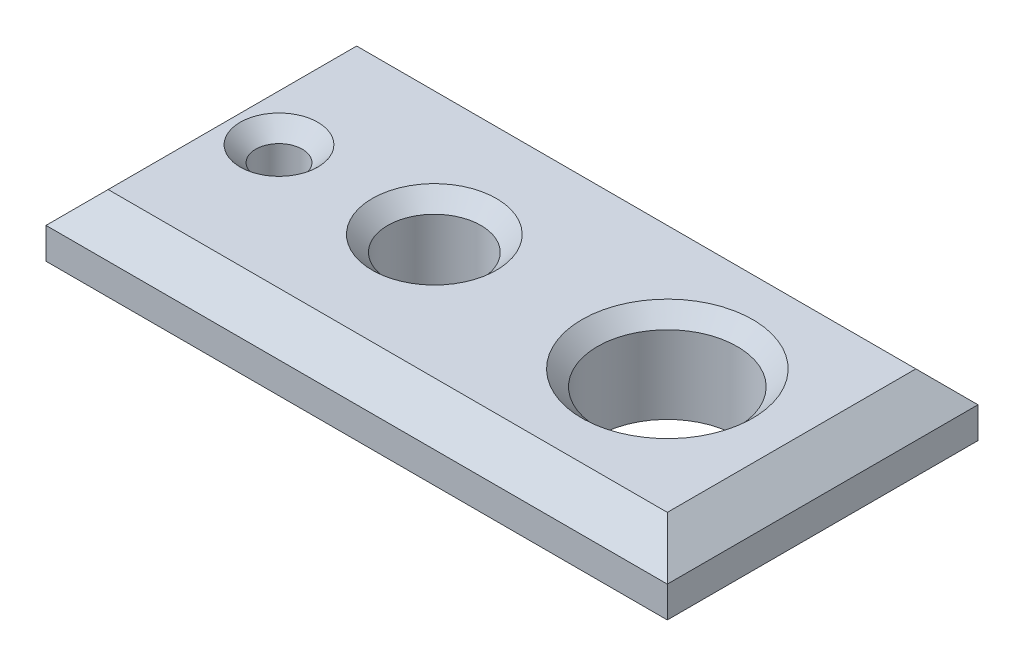
from build123d import *

# Parameters (mm, degrees)
CROQUIS1_W              = 200
CROQUIS1_H              = 30
SALIENTE_EXTRUIR1_DEPTH = 100
CHAFL_N1_SIZE           = 10
CHAFL_N2_SIZE           = 10
CROQUIS8_R              = 7.5
CROQUIS8_R_2            = 15
CROQUIS8_R_3            = 22.5
CORTAR_EXTRUIR5_DEPTH   = 226.610283454
CHAFL_N4_SIZE           = 5


with BuildPart() as part:
    # Croquis1 → Saliente-Extruir1 (new body)
    with BuildSketch(Plane.XY):
        with Locations((-100, 15)):
            Rectangle(CROQUIS1_W, CROQUIS1_H)
    extrude(amount=-SALIENTE_EXTRUIR1_DEPTH)

    # Chaflán1
    chafl_n1_edges = [part.edges().sort_by_distance(p)[0] for p in [
        (-200, 0, -50),
        (-200, 30, -50),
        (0, 30, -50),
        (0, 0, -50),
    ]]
    chamfer(chafl_n1_edges, length=CHAFL_N1_SIZE)

    # Chaflán2
    chafl_n2_edges = [part.edges().sort_by_distance(p)[0] for p in [
        (-100, 0, -100),
        (-100, 30, -100),
        (-100, 0, 0),
        (-100, 30, 0),
    ]]
    chamfer(chafl_n2_edges, length=CHAFL_N2_SIZE)

    # Croquis8 → Cortar-Extruir5 (cut, through all)
    with BuildSketch(Plane(origin=(0, 30, 0), x_dir=(1, 0, 0), z_dir=(0, 1, 0))):
        with Locations(Location((-175, 50, 0), (0, 0, 180))):
            Circle(CROQUIS8_R)
        with Locations(Location((-125, 50, 0), (0, 0, 180))):
            Circle(CROQUIS8_R_2)
        with Locations(Location((-50, 50, 0), (0, 0, 180))):
            Circle(CROQUIS8_R_3)
    extrude(amount=-CORTAR_EXTRUIR5_DEPTH, mode=Mode.SUBTRACT)

    # Chaflán4
    chafl_n4_edges = [part.edges().sort_by_distance(p)[0] for p in [
        (-167.5, 30, -50),
        (-110, 30, -50),
        (-27.5, 30, -50),
    ]]
    chamfer(chafl_n4_edges, length=CHAFL_N4_SIZE)


solid = part.part
